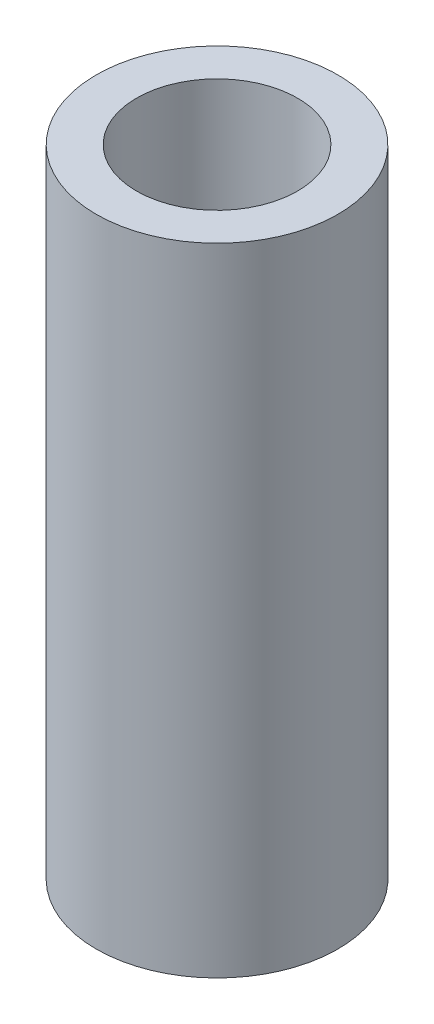
from build123d import *

# Parameters (mm, degrees)
SKETCH_1_R      = 7.5
SKETCH_1_R_2    = 5
EXTRUDE_1_DEPTH = 39.5


with BuildPart() as part:
    # 草图1 → 凸台-拉伸1 (new body)
    with BuildSketch(Plane(origin=(0, 0, 0), x_dir=(1, 0, 0), z_dir=(0, 1, 0))):
        with Locations(Location((0, 0, 0), (0, 0, 270))):
            Circle(SKETCH_1_R)
        with Locations(Location((0, 0, 0), (0, 0, 270))):
            Circle(SKETCH_1_R_2, mode=Mode.SUBTRACT)
    extrude(amount=EXTRUDE_1_DEPTH)


solid = part.part
